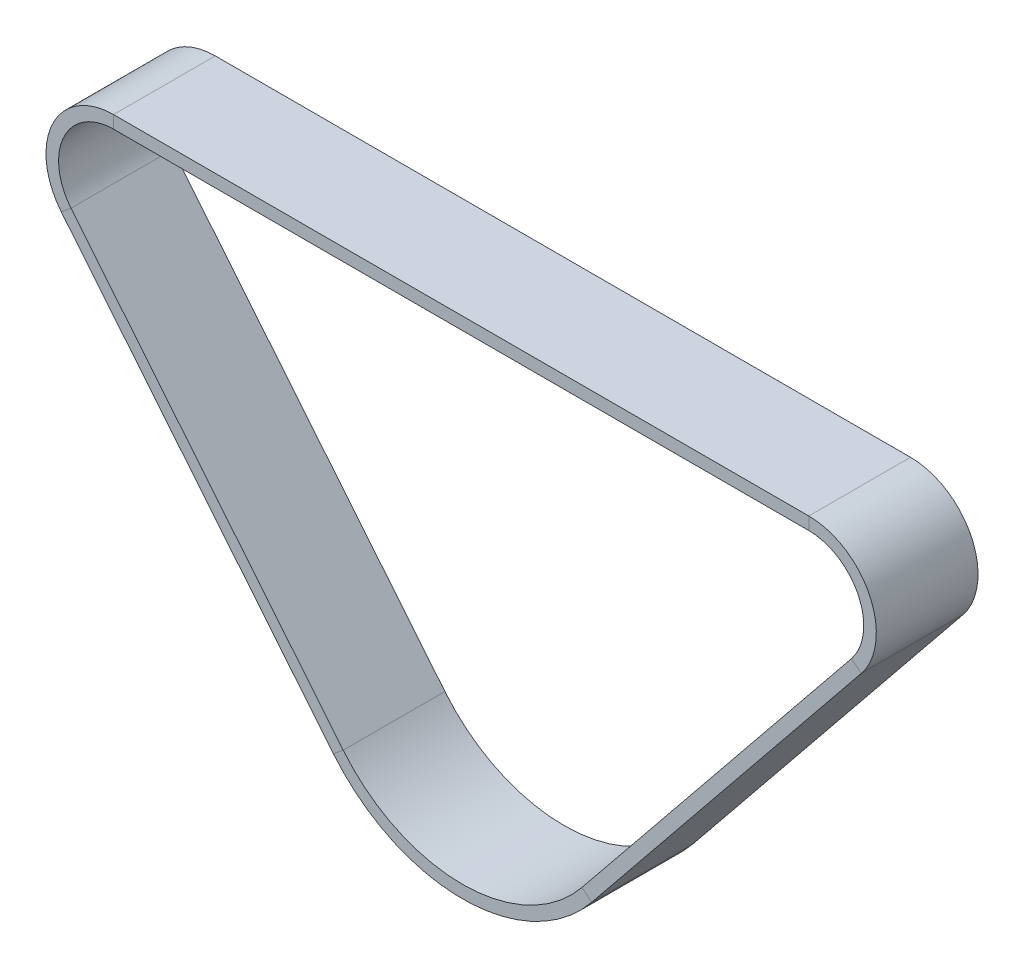
from build123d import *

# Parameters (mm, degrees)
SKETCH3_W = 12.7
SKETCH3_H = 1.5748


with BuildPart() as part:
    # Sweep1: sweep along a path in Sketch2
    with BuildLine(Plane.XY) as sweep1_path:
        Line((0, 7.65), (86.821816818, 7.65))
        ThreePointArc((86.821816818, 7.65), (93.726354726, 3.293912001), (92.767683557, -4.81343627))
        Line((92.767683557, -4.81343627), (59.105658053, -46.394939916))
        ThreePointArc((59.105658053, -46.394939916), (43.604317336, -53.810745697), (28.070931526, -46.462299284))
        Line((28.070931526, -46.462299284), (-5.924916158, -4.839201228))
        ThreePointArc((-5.924916158, -4.839201228), (-6.911670905, 3.278918313), (0, 7.65))
    # Sketch3 → Sweep1 (sweep)
    with BuildSketch(Plane(origin=(0, 0, 0), x_dir=(0, 0, -1), z_dir=(1, 0, 0))):
        with Locations((0, 7.65)):
            Rectangle(SKETCH3_W, SKETCH3_H)
    sweep(path=sweep1_path.line)


solid = part.part
